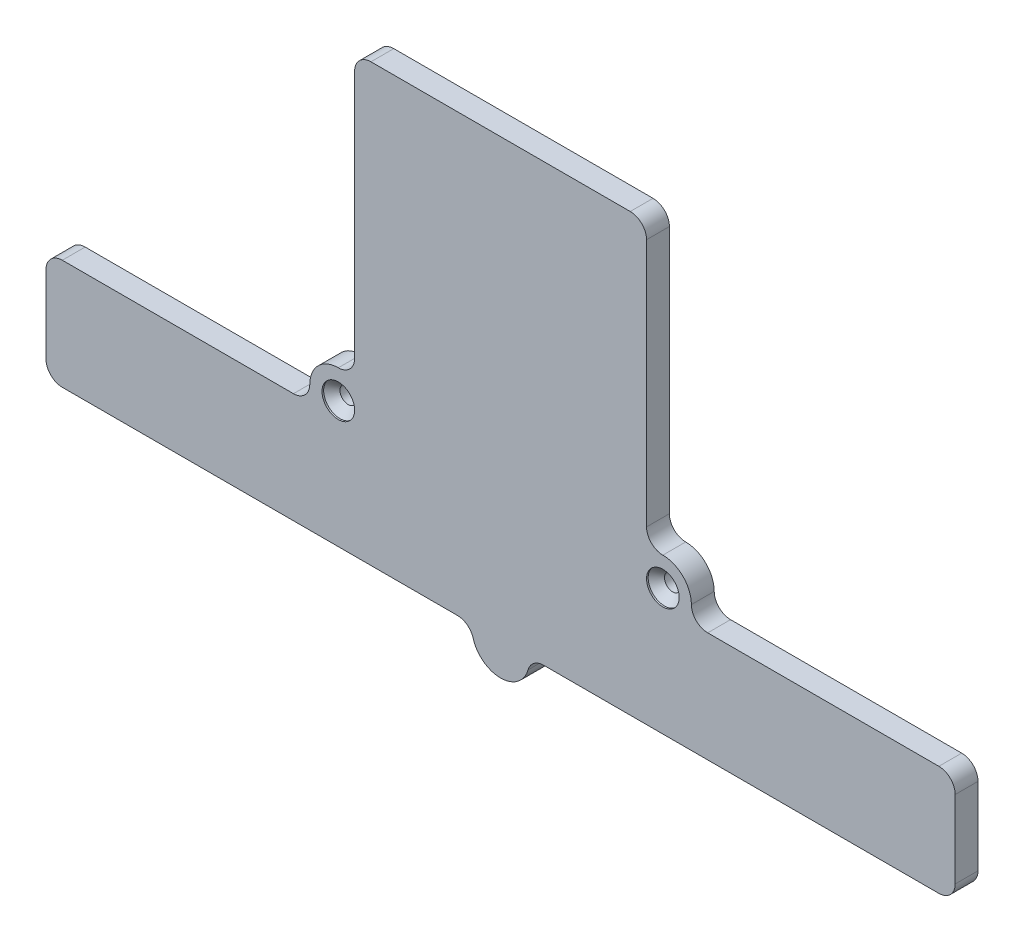
from build123d import *

# Parameters (mm, degrees)
BOSS_EXTRUDE1_DEPTH                            = 2.8
CUT_EXTRUDE1_REACH                             = 65.73
SKETCH3_R                                      = 1
CSK_FOR_M2_FLAT_HEAD_MACHINE_SCREW1_AT_2_COUNT = 2
CSK_FOR_M2_FLAT_HEAD_MACHINE_SCREW1_AT_2_PITCH = 39.8


with BuildPart() as part:
    # Sketch1 → Boss-Extrude1 (new body)
    with BuildSketch(Plane.XY):
        with BuildLine():
            Line((-53.75, -26.75), (-5.291502622, -26.75))
            ThreePointArc((-5.291502622, -26.75), (-4.085457244, -27.15455193), (-3.36731985, -28.204545455))
            ThreePointArc((-3.36731985, -28.204545455), (0, -30.75), (3.36731985, -28.204545455))
            ThreePointArc((3.36731985, -28.204545455), (4.085457244, -27.15455193), (5.291502622, -26.75))
            Line((5.291502622, -26.75), (53.75, -26.75))
            ThreePointArc((53.75, -26.75), (55.164213562, -26.164213562), (55.75, -24.75))
            Line((55.75, -24.75), (55.75, -15.25))
            ThreePointArc((55.75, -15.25), (55.164213562, -13.835786438), (53.75, -13.25))
            Line((53.75, -13.25), (25.4, -13.25))
            ThreePointArc((25.4, -13.25), (23.985786438, -12.664213562), (23.4, -11.25))
            ThreePointArc((23.4, -11.25), (22.374873734, -8.775126266), (19.9, -7.75))
            ThreePointArc((19.9, -7.75), (18.485786438, -7.164213562), (17.9, -5.75))
            Line((17.9, -5.75), (17.9, 24.75))
            ThreePointArc((17.9, 24.75), (17.314213562, 26.164213562), (15.9, 26.75))
            Line((15.9, 26.75), (-15.9, 26.75))
            ThreePointArc((-15.9, 26.75), (-17.314213562, 26.164213562), (-17.9, 24.75))
            Line((-17.9, 24.75), (-17.9, -5.75))
            ThreePointArc((-17.9, -5.75), (-18.485786438, -7.164213562), (-19.9, -7.75))
            ThreePointArc((-19.9, -7.75), (-22.374873734, -8.775126266), (-23.4, -11.25))
            ThreePointArc((-23.4, -11.25), (-23.985786438, -12.664213562), (-25.4, -13.25))
            Line((-25.4, -13.25), (-53.75, -13.25))
            ThreePointArc((-53.75, -13.25), (-55.164213562, -13.835786438), (-55.75, -15.25))
            Line((-55.75, -15.25), (-55.75, -24.75))
            ThreePointArc((-55.75, -24.75), (-55.164213562, -26.164213562), (-53.75, -26.75))
        make_face()
    extrude(amount=BOSS_EXTRUDE1_DEPTH)

    # Sketch3 → Cut-Extrude1 (cut, up to next)
    with BuildSketch(Plane.XY.offset(2.8), mode=Mode.PRIVATE) as cut_extrude1_sk1:
        with Locations((-19.9, -11.25)):
            Circle(SKETCH3_R)
    cut_extrude1_tool1 = extrude(cut_extrude1_sk1.sketch, amount=-CUT_EXTRUDE1_REACH, mode=Mode.PRIVATE) & part.part
    # Sketch3 → Cut-Extrude1 (cut, up to next)
    with BuildSketch(Plane.XY.offset(2.8), mode=Mode.PRIVATE) as cut_extrude1_sk2:
        with Locations((19.9, -11.25)):
            Circle(SKETCH3_R)
    cut_extrude1_tool2 = extrude(cut_extrude1_sk2.sketch, amount=-CUT_EXTRUDE1_REACH, mode=Mode.PRIVATE) & part.part
    add(cut_extrude1_tool1.solids().sort_by_distance((-19.9, -11.25, 2.8))[0], mode=Mode.SUBTRACT)
    add(cut_extrude1_tool2.solids().sort_by_distance((19.9, -11.25, 2.8))[0], mode=Mode.SUBTRACT)

    # Sketch4 → CSK for M2 Flat Head Machine Screw1 (revolve, cut)
    with BuildSketch(Plane(origin=(-19.9, -11.25, 2.8), x_dir=(0, -1, 0), z_dir=(1, 0, 0))):
        Polygon((0, 0), (0, 2.8), (1, 2.8), (1, 1.2), (2, 0.2), (2, 0), align=None)
    csk_for_m2_flat_head_machine_screw1 = revolve(axis=Axis((-19.9, -11.25, 9.15), (0, 0, -1)), mode=Mode.SUBTRACT)

    # CSK for M2 Flat Head Machine Screw1 at 2: CSK for M2 Flat Head Machine Screw1 ×2
    with Locations(*[(i * CSK_FOR_M2_FLAT_HEAD_MACHINE_SCREW1_AT_2_PITCH, 0, 0) for i in range(1, CSK_FOR_M2_FLAT_HEAD_MACHINE_SCREW1_AT_2_COUNT)]):
        add(csk_for_m2_flat_head_machine_screw1, mode=Mode.SUBTRACT)


solid = part.part
